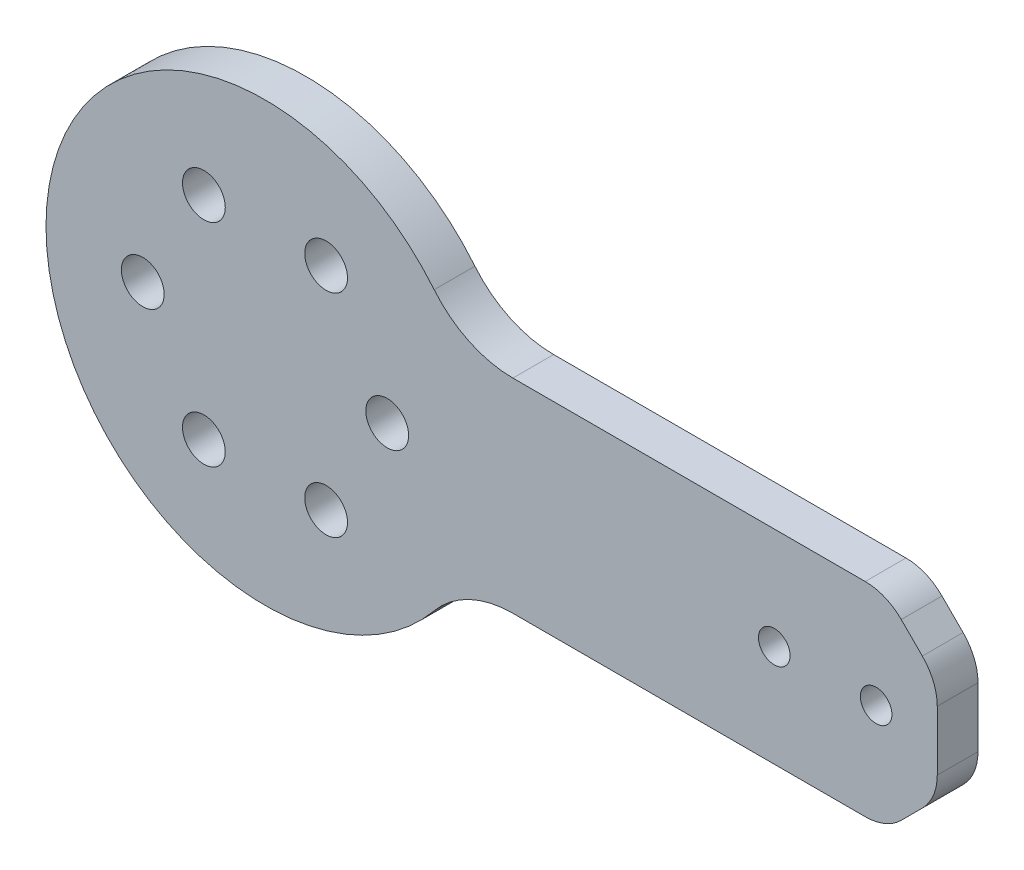
from build123d import *

# Parameters (mm, degrees)
SKETCH_1_R          = 2.1
EXTRUDE_1_DEPTH     = 4
CHAMFER_1_SIZE      = 5
SKETCH_2_R          = 1.55
CUT_EXTRUDE_1_DEPTH = 70.528771023
FILLET_1_R          = 10
FILLET_2_R          = 5


with BuildPart() as part:
    # 草图1 → 凸台-拉伸1 (new body)
    with BuildSketch(Plane.XY):
        with BuildLine():
            Line((19.032866311, 10), (66, 10))
            Line((66, 10), (66, -10))
            Line((66, -10), (19.032866311, -10))
            ThreePointArc((19.032866311, -10), (-21.5, 0), (19.032866311, 10))
        make_face()
        with Locations((12, 0)):
            Circle(SKETCH_1_R, mode=Mode.SUBTRACT)
        with Locations((6, -10.392304845)):
            Circle(SKETCH_1_R, mode=Mode.SUBTRACT)
        with Locations((-6, -10.392304845)):
            Circle(SKETCH_1_R, mode=Mode.SUBTRACT)
        with Locations((-12, 0)):
            Circle(SKETCH_1_R, mode=Mode.SUBTRACT)
        with Locations((-6, 10.392304845)):
            Circle(SKETCH_1_R, mode=Mode.SUBTRACT)
        with Locations((6, 10.392304845)):
            Circle(SKETCH_1_R, mode=Mode.SUBTRACT)
    extrude(amount=EXTRUDE_1_DEPTH)

    # 倒角1
    chamfer_1_edges = [part.edges().sort_by_distance(p)[0] for p in [
        (66, 10, 2),
        (66, -10, 2),
    ]]
    chamfer(chamfer_1_edges, length=CHAMFER_1_SIZE)

    # 草图2 → 切除-拉伸1 (cut, through all)
    with BuildSketch(Plane.XY.offset(4)):
        with Locations((60, 0)):
            Circle(SKETCH_2_R)
        with Locations((50, 0)):
            Circle(SKETCH_2_R)
    extrude(amount=-CUT_EXTRUDE_1_DEPTH, mode=Mode.SUBTRACT)

    # 圆角1
    fillet_1_edges = [part.edges().sort_by_distance(p)[0] for p in [
        (19.032866311, 10, 2),
        (19.032866311, -10, 2),
    ]]
    fillet(fillet_1_edges, radius=FILLET_1_R)

    # 圆角2
    fillet_2_edges = [part.edges().sort_by_distance(p)[0] for p in [
        (66, 5, 2),
        (66, -5, 2),
        (61, -10, 2),
        (61, 10, 2),
    ]]
    fillet(fillet_2_edges, radius=FILLET_2_R)


solid = part.part
